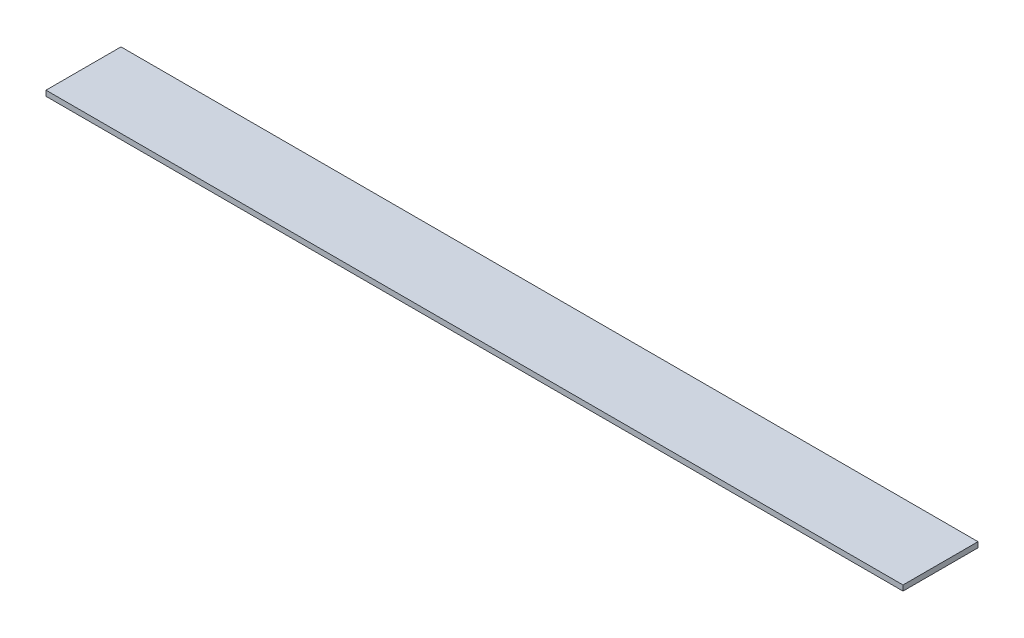
from build123d import *

# Parameters (mm, degrees)
SKETCH2_W           = 1.6
SKETCH2_H           = 0.14
BOSS_EXTRUDE1_DEPTH = 0.01


with BuildPart() as part:
    # Sketch2 → Boss-Extrude1 (new body)
    with BuildSketch(Plane(origin=(0, 0, 0), x_dir=(1, 0, 0), z_dir=(0, 1, 0))):
        Rectangle(SKETCH2_W, SKETCH2_H)
    extrude(amount=BOSS_EXTRUDE1_DEPTH)


solid = part.part
